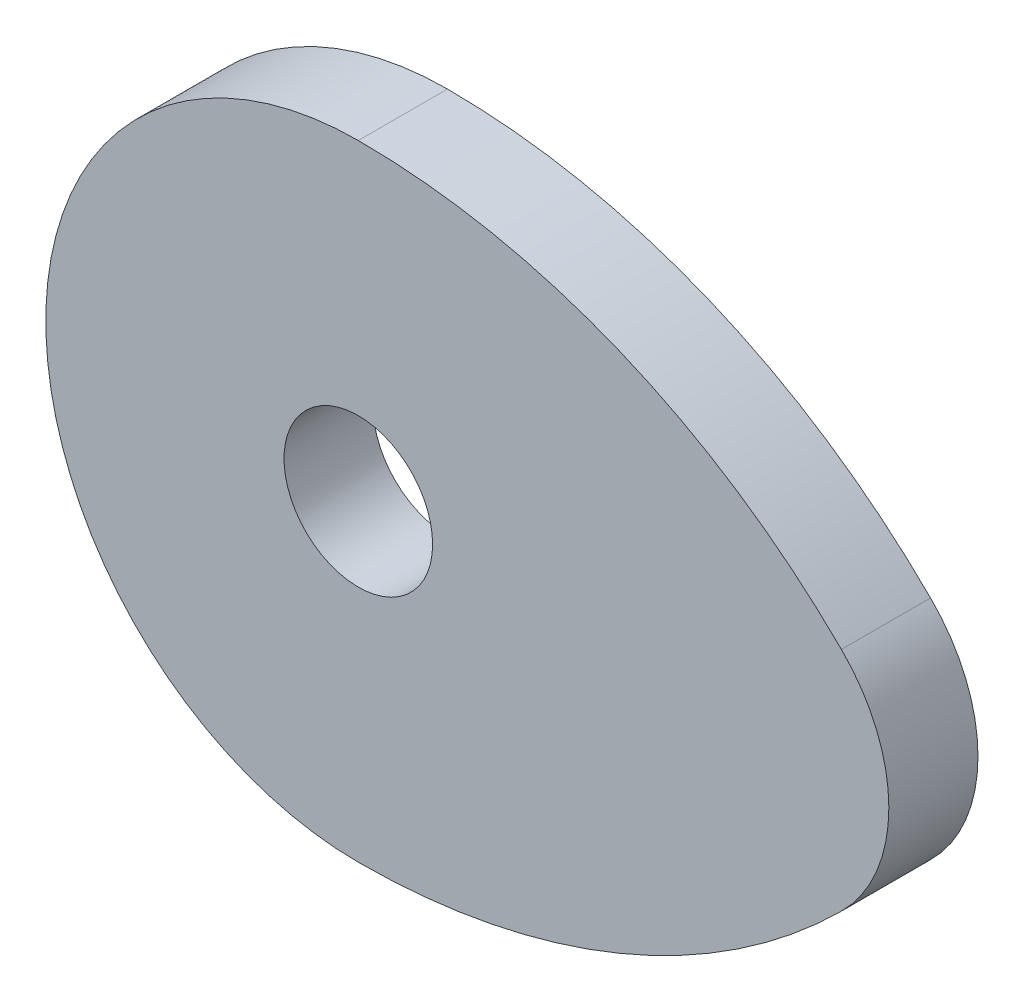
from build123d import *

# Parameters (mm, degrees)
SKETCH1_R           = 5
BOSS_EXTRUDE3_DEPTH = 6


with BuildPart() as part:
    # Sketch1 → Boss-Extrude3 (new body)
    with BuildSketch(Plane.XY):
        with BuildLine():
            ThreePointArc((0, 21.034581504), (-21.034581504, 0), (0, -21.034581504))
            ThreePointArc((0, -21.034581504), (17.584571554, -17.551352165), (32.513452001, -7.627715134))
            ThreePointArc((32.513452001, -7.627715134), (35.706726817, 0), (32.513452001, 7.627715134))
            ThreePointArc((32.513452001, 7.627715134), (17.584571554, 17.551352165), (0, 21.034581504))
        make_face()
        Circle(SKETCH1_R, mode=Mode.SUBTRACT)
    extrude(amount=BOSS_EXTRUDE3_DEPTH)


solid = part.part
